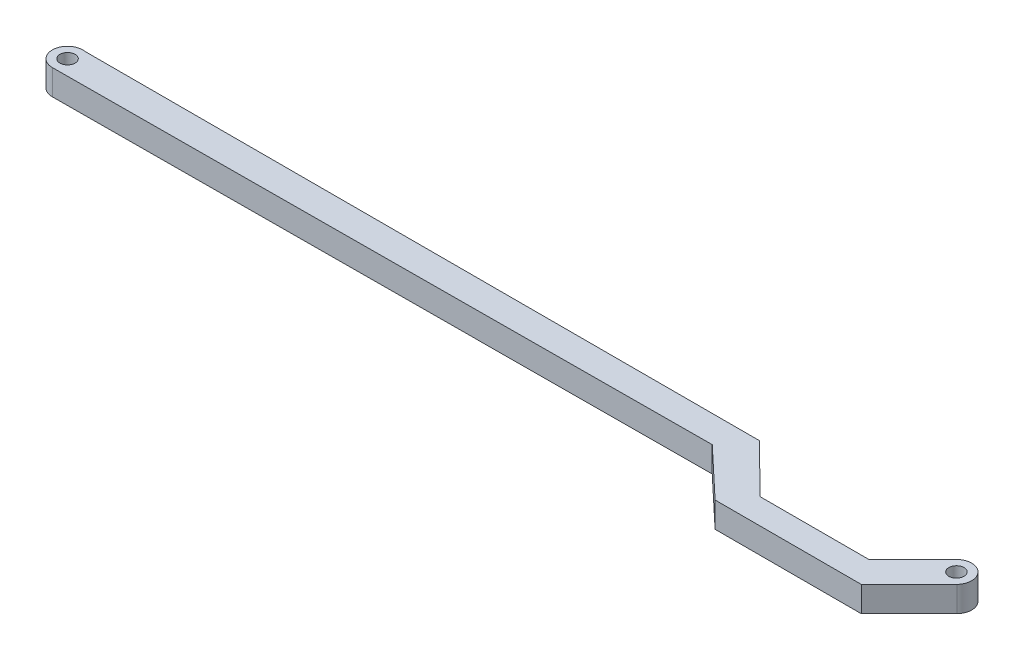
from build123d import *

# Parameters (mm, degrees)
CROQUIS1_R              = 1.5
SALIENTE_EXTRUIR1_DEPTH = 5


with BuildPart() as part:
    # Croquis1 → Saliente-Extruir1 (new body)
    with BuildSketch(Plane(origin=(0, 0, 0), x_dir=(1, 0, 0), z_dir=(0, 1, 0))):
        with BuildLine():
            Line((0, -3), (129.261088854, -2.336866912))
            Line((129.261088854, -2.336866912), (138.979125155, -11.494366527))
            Line((138.979125155, -11.494366527), (167.76042343, -11.494366527))
            Line((167.76042343, -11.494366527), (177.151035775, -2.091182702))
            ThreePointArc((177.151035775, -2.091182702), (176.95596642, 2.274685773), (172.610149506, 1.813453781))
            Line((172.610149506, 1.813453781), (164.264425587, -6.494366527))
            Line((164.264425587, -6.494366527), (142.859531648, -6.494366527))
            Line((142.859531648, -6.494366527), (133.197849193, 2.991093014))
            Line((133.197849193, 2.991093014), (0.470896611, 2.962812242))
            ThreePointArc((0.470896611, 2.962812242), (-2.99068861, 0.236181365), (0, -3))
        make_face()
        with Locations(Location((0, 0, 0), (0, 0, 270))):
            Circle(CROQUIS1_R, mode=Mode.SUBTRACT)
        with Locations(Location((175, 0, 0), (0, 0, 270))):
            Circle(CROQUIS1_R, mode=Mode.SUBTRACT)
    extrude(amount=SALIENTE_EXTRUIR1_DEPTH)


solid = part.part
